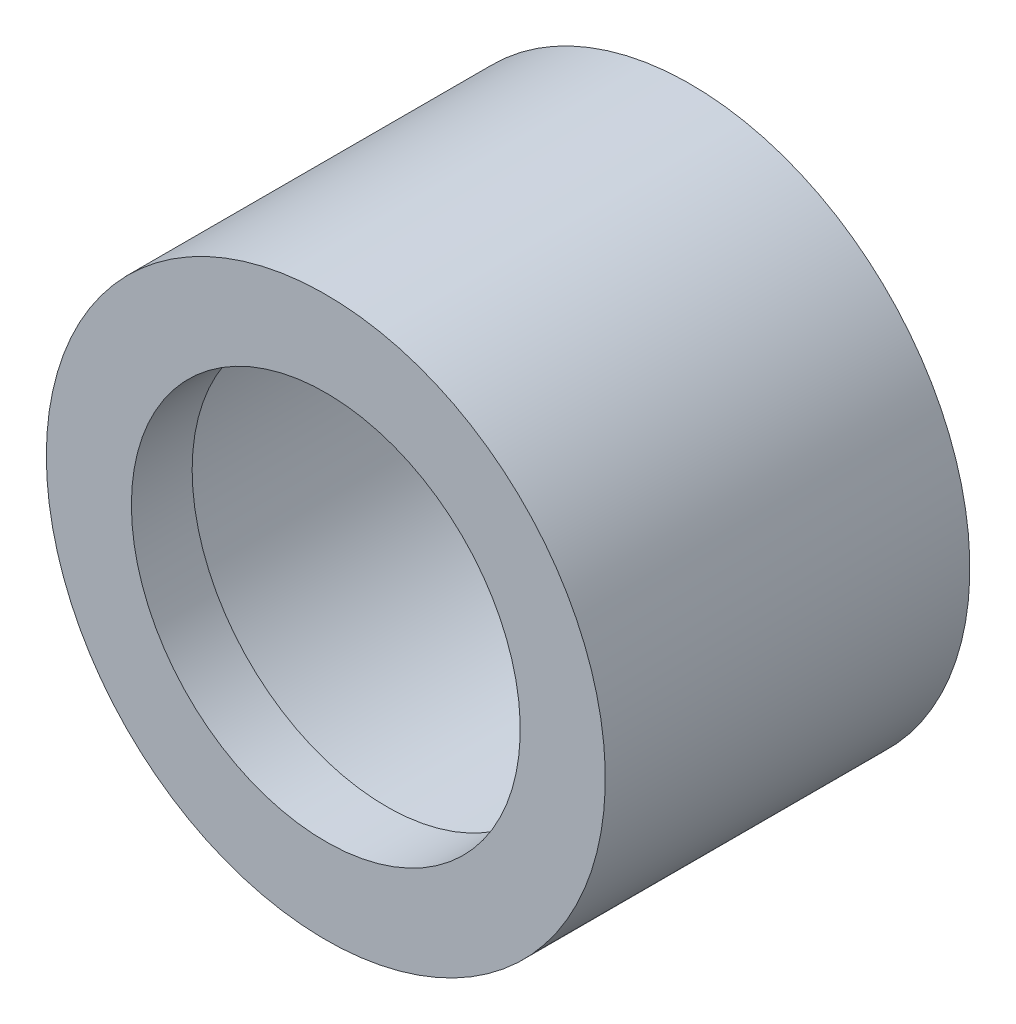
from build123d import *


with BuildPart() as part:
    # Sketch1 → Revolve1 (revolve)
    with BuildSketch(Plane(origin=(0, 0, 0), x_dir=(1, 0, 0), z_dir=(0, 1, 0))):
        Polygon((-11.5, 15), (-11.5, 0), (-8, 0), (-8, 2.5), (-9.5, 2.5), (-9.5, 15), align=None)
    revolve(axis=Axis((0, 0, -55.960235465), (0, 0, 1)))


solid = part.part
